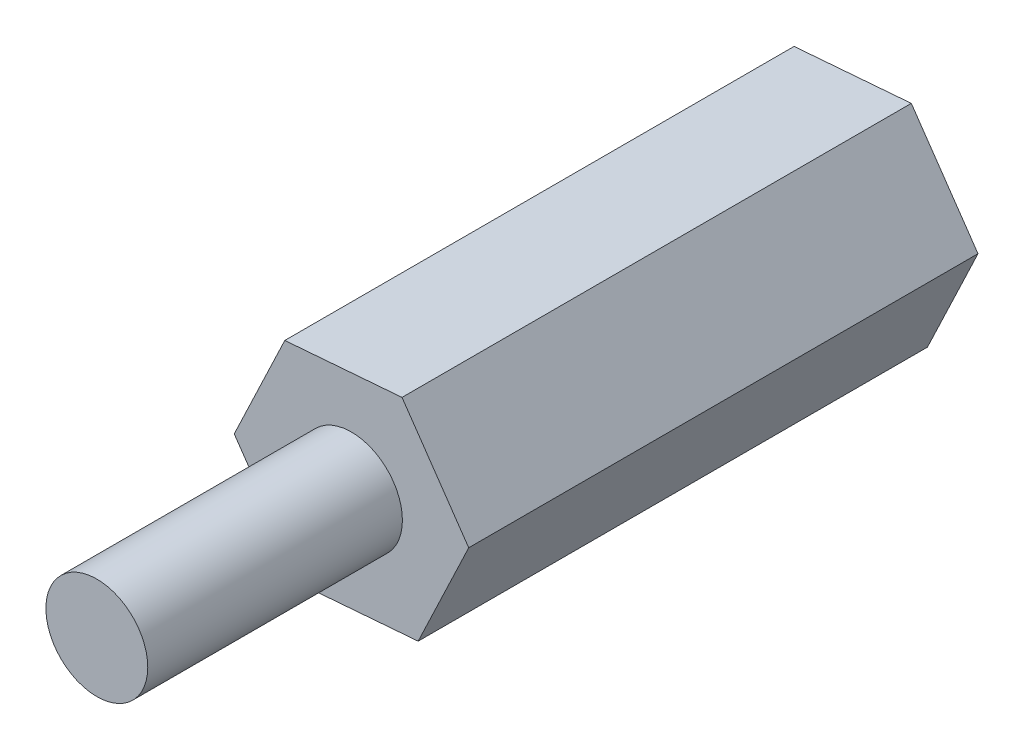
from build123d import *

# Parameters (mm, degrees)
BOSS_EXTRU_1_DEPTH      = 10
ESQUISSE2_R             = 1
BOSS_EXTRU_2_DEPTH      = 5
ESQUISSE3_R             = 1
ENL_V_MAT_EXTRU_1_DEPTH = 5


with BuildPart() as part:
    # Esquisse1 → Boss.-Extru.1 (new body)
    with BuildSketch(Plane.XY):
        Polygon((2.302144648, 0.182929919), (0.992650367, 2.085180707), (-1.309494281, 1.902250788), (-2.302144648, -0.182929919), (-0.992650367, -2.085180707), (1.309494281, -1.902250788), align=None)
    extrude(amount=BOSS_EXTRU_1_DEPTH)

    # Esquisse2 → Boss.-Extru.2 (add)
    with BuildSketch(Plane.XY.offset(10)):
        Circle(ESQUISSE2_R)
    extrude(amount=BOSS_EXTRU_2_DEPTH)

    # Esquisse3 → Enlèv. mat.-Extru.1 (cut)
    with BuildSketch(Plane(origin=(0, 0, 0), x_dir=(-1, 0, 0), z_dir=(0, 0, -1))):
        with Locations(Location((0, 0, 0), (0, 0, 180))):
            Circle(ESQUISSE3_R)
    extrude(amount=-ENL_V_MAT_EXTRU_1_DEPTH, mode=Mode.SUBTRACT)


solid = part.part
